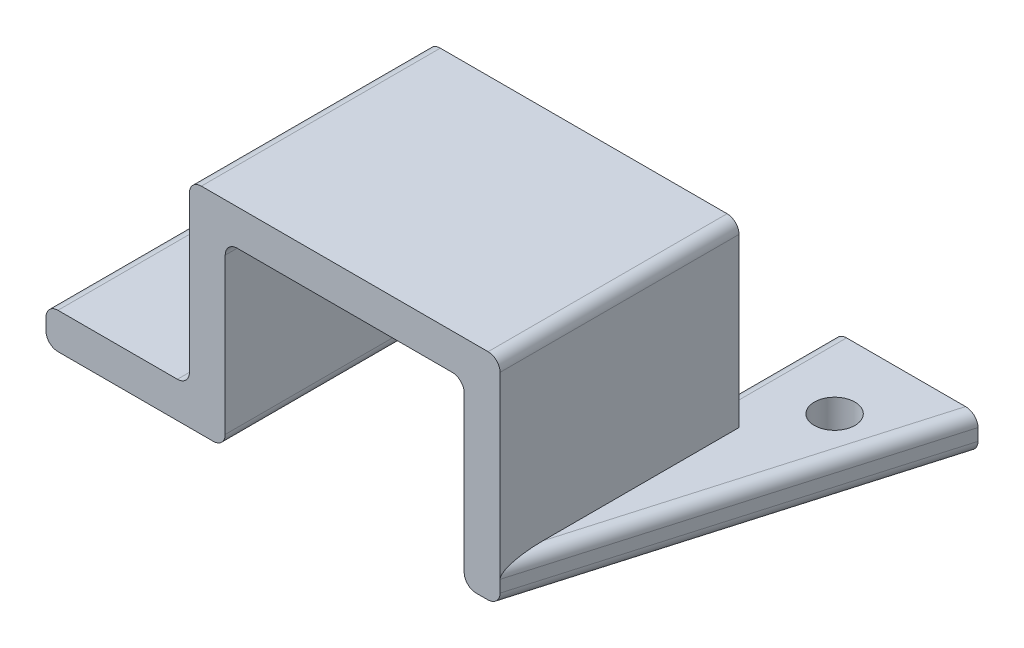
from build123d import *

# Parameters (mm, degrees)
BOSS_EXTRUDE1_DEPTH  = 20
SKETCH7_W            = 12
SKETCH7_H            = 20
BOSS_EXTRUDE2_DEPTH  = 3
M3_CLEARANCE_HOLE2_D = 3.4
FILLET1_R            = 1


with BuildPart() as part:
    # Sketch3 → Boss-Extrude1 (new body)
    with BuildSketch(Plane.XY):
        Polygon((3, 0), (3, 15), (23, 15), (23, 0), (26, 0), (26, 18), (0, 18), (0, 0), align=None)
    extrude(amount=BOSS_EXTRUDE1_DEPTH)

    # Sketch7 → Boss-Extrude2 (add)
    with BuildSketch(Plane(origin=(0, 0, 0), x_dir=(1, 0, 0), z_dir=(0, 1, 0))):
        Polygon((26, -20), (35, 11), (23, 11), (23, 0), (26, 0), align=None)
        with Locations((-6, -10)):
            Rectangle(SKETCH7_W, SKETCH7_H)
    extrude(amount=BOSS_EXTRUDE2_DEPTH)

    # M3 Clearance Hole2 (through all)
    with Locations(Plane(origin=(0, 3, 0), x_dir=(1, 0, 0), z_dir=(0, 1, 0))):
        with Locations((29, 5), (-6, -10)):
            Hole(M3_CLEARANCE_HOLE2_D / 2)

    # Fillet1
    fillet1_edges = [part.edges().sort_by_distance(p)[0] for p in [
        (0, 18, 10),
        (26, 18, 10),
        (23, 0, 4.5),
        (23, 15, 10),
        (3, 15, 10),
        (3, 0, 10),
        (30.5, 0, 4.5),
        (30.5, 3, 4.5),
        (23, 3, -5.5),
        (-12, 0, 10),
        (0, 3, 10),
        (-12, 3, 10),
    ]]
    fillet(fillet1_edges, radius=FILLET1_R)


solid = part.part
